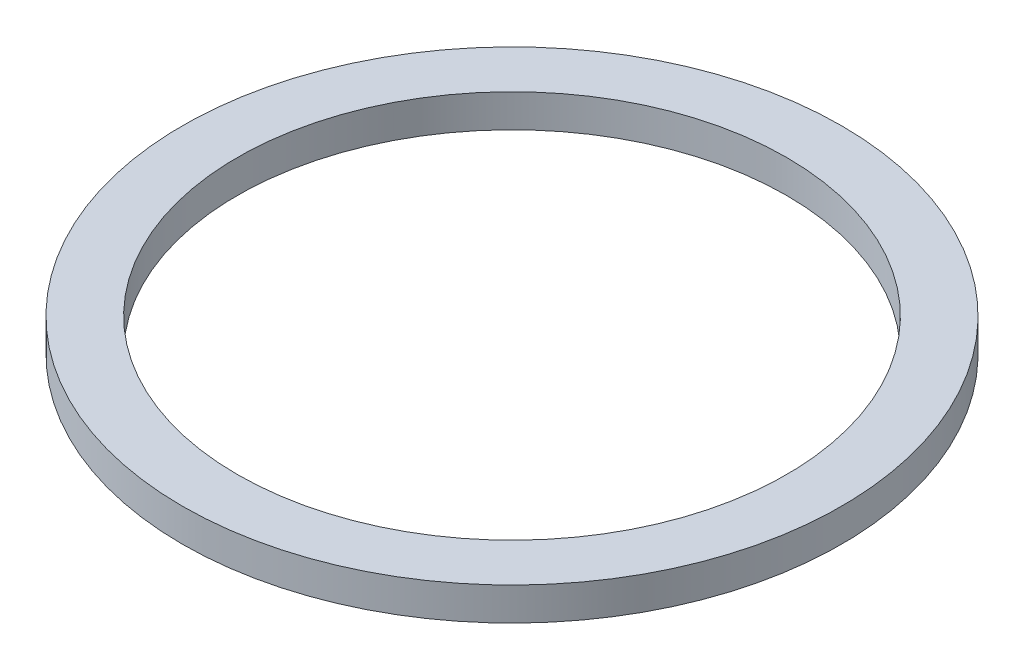
from build123d import *

# Parameters (mm, degrees)
SKETCH_1_R      = 30
SKETCH_1_R_2    = 25
EXTRUDE_1_DEPTH = 3


with BuildPart() as part:
    # 草图1 → 凸台-拉伸1 (new body)
    with BuildSketch(Plane(origin=(0, 0, 0), x_dir=(1, 0, 0), z_dir=(0, 1, 0))):
        with Locations(Location((0, 0, 0), (0, 0, 270))):
            Circle(SKETCH_1_R)
        with Locations(Location((0, 0, 0), (0, 0, 270))):
            Circle(SKETCH_1_R_2, mode=Mode.SUBTRACT)
    extrude(amount=EXTRUDE_1_DEPTH)


solid = part.part
